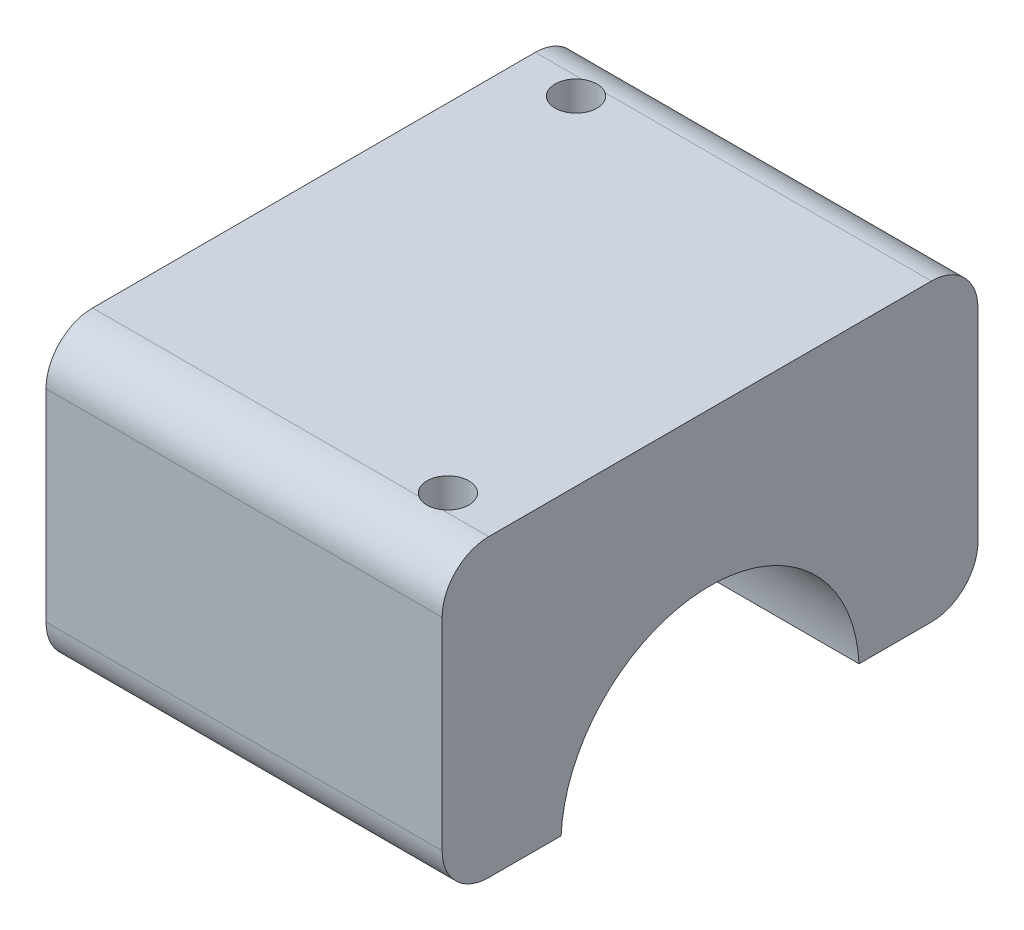
from build123d import *

# Parameters (mm, degrees)
BOSS_EXTRUDE1_DEPTH     = 17
CUT_EXTRUDE1_DEPTH      = 39.619352675
CUT_EXTRUDE1_DEPTH_BACK = 39.619352675
SKETCH2_R               = 12.8
SKETCH3_R               = 1.8
CUT_EXTRUDE2_DEPTH      = 25.951


with BuildPart() as part:
    # Sketch1 → Boss-Extrude1 (new, symmetric)
    with BuildSketch(Plane(origin=(0, 0, 0), x_dir=(0, 0, -1), z_dir=(1, 0, 0))):
        with BuildLine():
            Line((-19, 0.6), (19, 0.6))
            ThreePointArc((19, 0.6), (21.828427125, 1.771572875), (23, 4.6))
            Line((23, 4.6), (23, 21.951))
            ThreePointArc((23, 21.951), (21.828427125, 24.779427125), (19, 25.951))
            Line((19, 25.951), (-19, 25.951))
            ThreePointArc((-19, 25.951), (-21.828427125, 24.779427125), (-23, 21.951))
            Line((-23, 21.951), (-23, 4.6))
            ThreePointArc((-23, 4.6), (-21.828427125, 1.771572875), (-19, 0.6))
        make_face()
    extrude(amount=BOSS_EXTRUDE1_DEPTH, both=True)

    # Sketch2 → Cut-Extrude1 (cut, two sides: drawn at the far end of the back side and taken through both)
    with BuildSketch(Plane(origin=(0, 0, 0), x_dir=(0, 0, -1), z_dir=(1, 0, 0)).offset(-CUT_EXTRUDE1_DEPTH_BACK)):
        Circle(SKETCH2_R)
    extrude(amount=CUT_EXTRUDE1_DEPTH + CUT_EXTRUDE1_DEPTH_BACK, mode=Mode.SUBTRACT)

    # Sketch3 → Cut-Extrude2 (cut)
    with BuildSketch(Plane(origin=(0, 0.6, 0), x_dir=(1, 0, 0), z_dir=(0, 1, 0))):
        with Locations(Location((12, -17.5, 0), (0, 0, 236.442690238))):
            Circle(SKETCH3_R)
        with Locations(Location((-12, 17.5, 0), (0, 0, 123.557309762))):
            Circle(SKETCH3_R)
    extrude(amount=CUT_EXTRUDE2_DEPTH, mode=Mode.SUBTRACT)


solid = part.part
